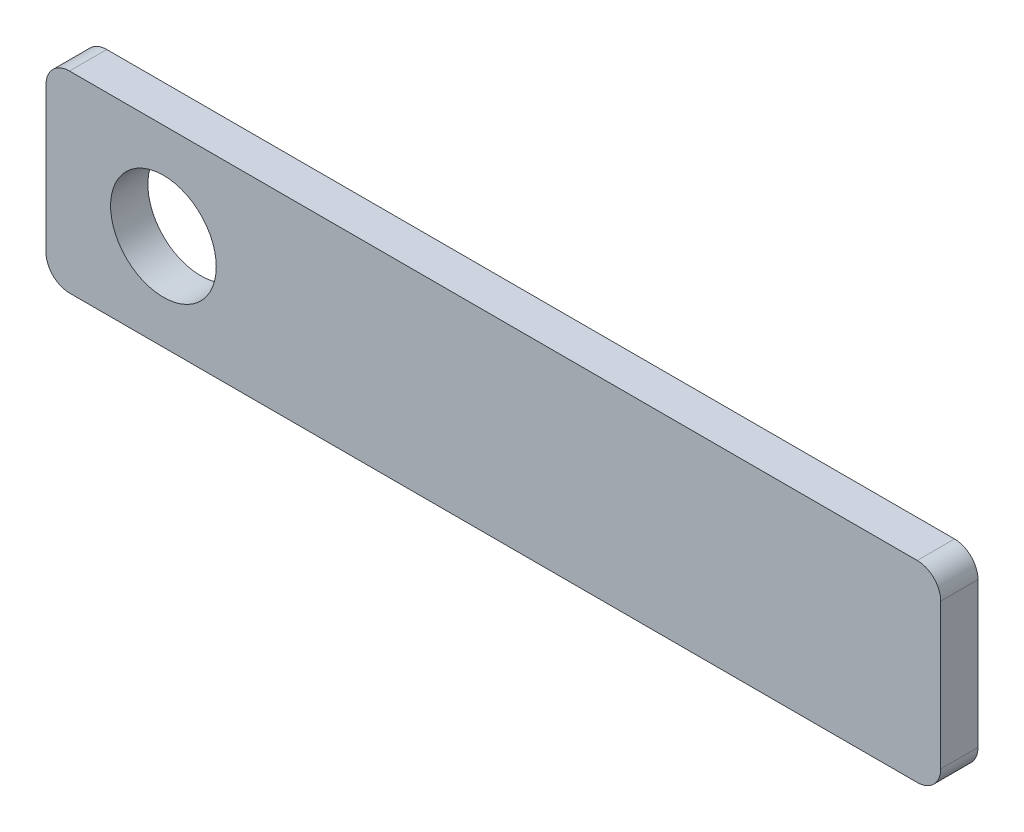
from build123d import *

# Parameters (mm, degrees)
SKETCH1_W            = 76.2
SKETCH1_H            = 16.378
BOSS_EXTRUDE1_DEPTH  = 3.175
FILLET1_R            = 2
M8_CLEARANCE_HOLE1_D = 9


with BuildPart() as part:
    # Sketch1 → Boss-Extrude1 (new body)
    with BuildSketch(Plane.XY):
        with Locations((38.1, -8.189)):
            Rectangle(SKETCH1_W, SKETCH1_H)
    extrude(amount=BOSS_EXTRUDE1_DEPTH)

    # Fillet1
    fillet1_edges = [part.edges().sort_by_distance(p)[0] for p in [
        (0, 0, 1.5875),
        (76.2, 0, 1.5875),
        (76.2, -16.378, 1.5875),
        (0, -16.378, 1.5875),
    ]]
    fillet(fillet1_edges, radius=FILLET1_R)

    # M8 Clearance Hole1 (through all)
    with Locations(Plane.XY.offset(3.175)):
        with Locations((10, -8.189)):
            Hole(M8_CLEARANCE_HOLE1_D / 2)


solid = part.part
